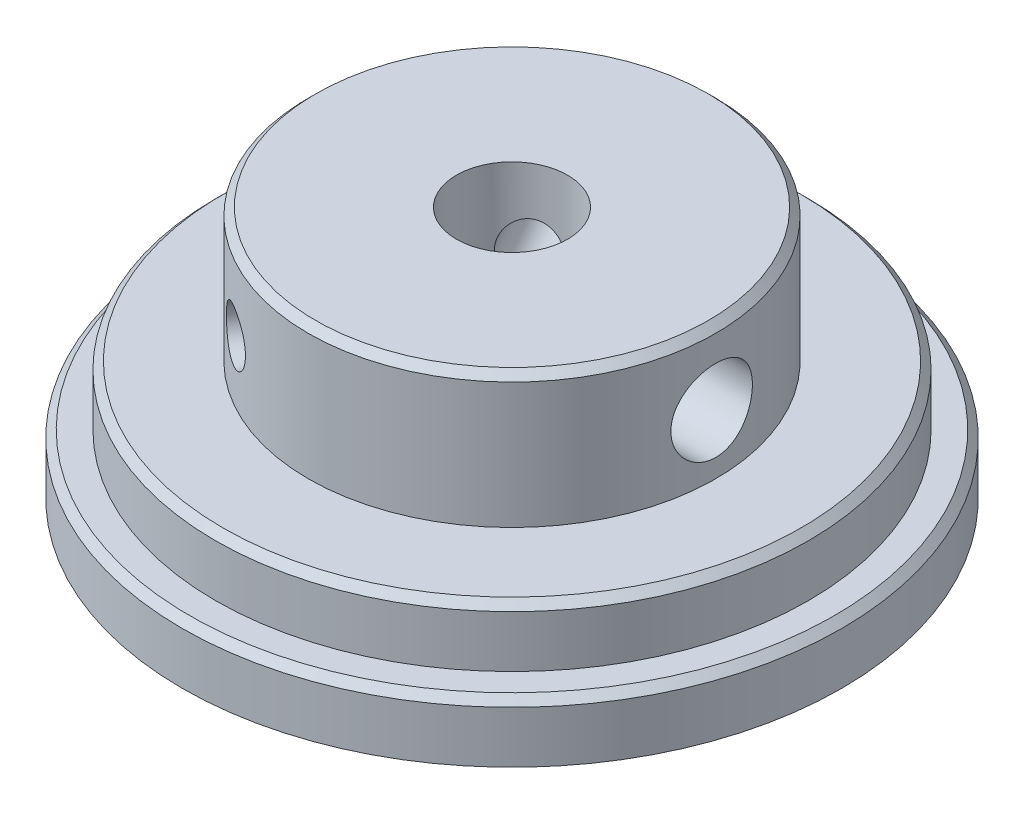
from build123d import *

# Parameters (mm, degrees)
FORO_11_0_11_1_REACH  = 93.215
FORO_11_0_11_1_BORE_R = 5.5
FORO_7_0_7_1_REACH    = 98.001
FORO_7_0_7_1_BORE_R   = 3.5
SMUSSO1_SIZE          = 1


with BuildPart() as part:
    # Schizzo2 → Rivoluzione1 (revolve)
    with BuildSketch(Plane.XY, mode=Mode.PRIVATE) as rivoluzione1_sk:
        Polygon((7.5, 0), (44.5, 0), (44.5, 8), (40, 8), (40, 16), (27.5, 16), (27.5, 34), (7.5, 34), align=None)
    revolve(rivoluzione1_sk.sketch.rotate(Axis((0, 38.394132613, 0), (0, -1, 0)), 90), axis=Axis((0, 38.394132613, 0), (0, -1, 0)))

    # Foro Ø11.0 (11)-1 bore → Foro Ø11.0 (11)-1 (cut, up to next)
    with BuildSketch(Plane(origin=(27.5, 0, 0), x_dir=(0, 0, -1), z_dir=(1, 0, 0)), mode=Mode.PRIVATE) as foro_11_0_11_1_sk1:
        with Locations((0, 24)):
            Circle(FORO_11_0_11_1_BORE_R)
    foro_11_0_11_1_tool1 = extrude(foro_11_0_11_1_sk1.sketch, amount=-FORO_11_0_11_1_REACH, mode=Mode.PRIVATE) & part.part
    add(foro_11_0_11_1_tool1.solids().sort_by_distance((27.5, 24, 0))[0], mode=Mode.SUBTRACT)

    # Foro Ø7.0 (7)-1 bore → Foro Ø7.0 (7)-1 (cut, up to next)
    with BuildSketch(Plane(origin=(-13.75, 0, 23.815698604), x_dir=(0, 1, 0), z_dir=(-0.500000000000001, 0, 0.866025403784438)), mode=Mode.PRIVATE) as foro_7_0_7_1_sk1:
        with Locations((24, 0)):
            Circle(FORO_7_0_7_1_BORE_R)
    foro_7_0_7_1_tool1 = extrude(foro_7_0_7_1_sk1.sketch, amount=-FORO_7_0_7_1_REACH, mode=Mode.PRIVATE) & part.part
    foro_7_0_7_1 = foro_7_0_7_1_tool1.solids().sort_by_distance((-13.75, 24, 23.815699))[0]
    add(foro_7_0_7_1, mode=Mode.SUBTRACT)

    # Specchia1: Foro Ø7.0 (7)-1 across plane
    add(foro_7_0_7_1.mirror(Plane.XY), mode=Mode.SUBTRACT)

    # Smusso1
    smusso1_edges = [part.edges().sort_by_distance(p)[0] for p in [
        (0, 34, -27.5),
        (0, 16, -40),
        (0, 8, -44.5),
    ]]
    chamfer(smusso1_edges, length=SMUSSO1_SIZE)


solid = part.part
